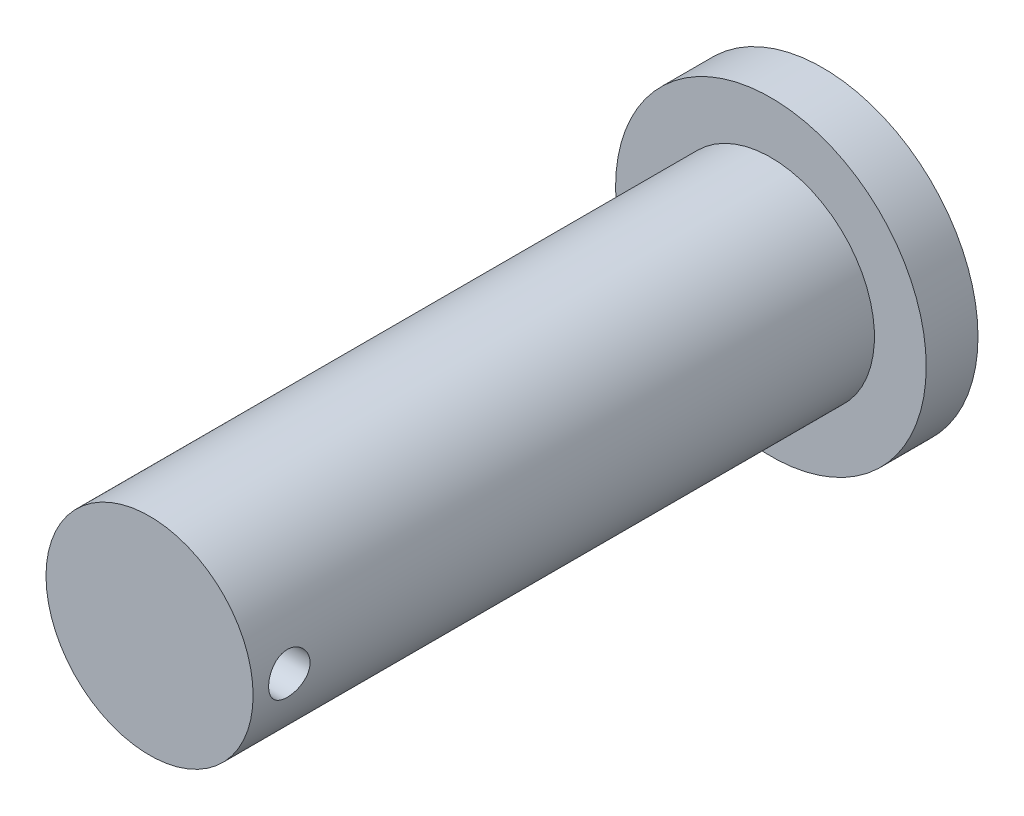
from build123d import *

# Parameters (mm, degrees)
SKETCH1_R               = 10
BOSS_EXTRUDE1_DEPTH     = 65
CUT_EXTRUDE1_DEPTH      = 18
CUT_EXTRUDE1_DEPTH_BACK = 16
SKETCH2_R               = 2
SKETCH5_R               = 15
BOSS_EXTRUDE3_DEPTH     = 5
SCALE1_SCALE            = 0.5


with BuildPart() as part:
    # Sketch1 → Boss-Extrude1 (new body)
    with BuildSketch(Plane.XY):
        Circle(SKETCH1_R)
    extrude(amount=BOSS_EXTRUDE1_DEPTH)

    # Sketch2 → Cut-Extrude1 (cut, two sides: drawn at the far end of the back side and taken through both)
    with BuildSketch(Plane(origin=(0, 0, 0), x_dir=(0, 0, -1), z_dir=(1, 0, 0)).offset(-CUT_EXTRUDE1_DEPTH_BACK)):
        with Locations(Location((-61.5, 0, 0), (0, 0, 180))):
            Circle(SKETCH2_R)
    extrude(amount=CUT_EXTRUDE1_DEPTH + CUT_EXTRUDE1_DEPTH_BACK, mode=Mode.SUBTRACT)

    # Sketch5 → Boss-Extrude3 (add)
    with BuildSketch(Plane(origin=(0, 0, 0), x_dir=(-1, 0, 0), z_dir=(0, 0, -1))):
        Circle(SKETCH5_R)
    extrude(amount=-BOSS_EXTRUDE3_DEPTH)


with BuildPart() as part_1:
    # Scale1: scaled about (0, 0, 0)
    add(part.part.scale(SCALE1_SCALE))


solid = part_1.part
